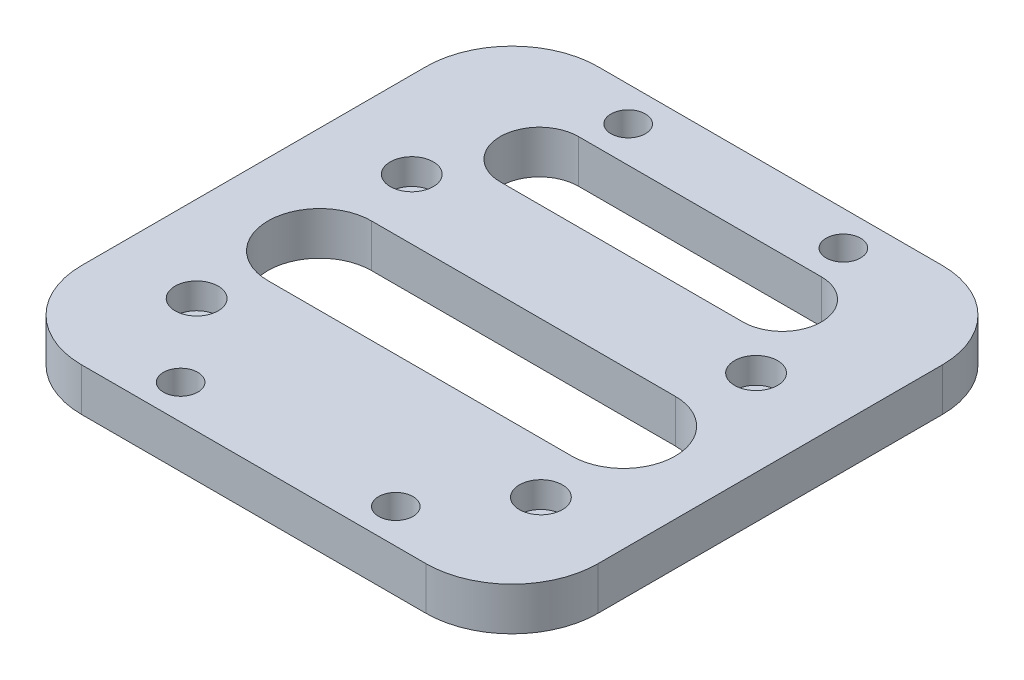
from build123d import *

# Parameters (mm, degrees)
ESQUISSE1_W             = 60
ESQUISSE1_H             = 60
BOSS_EXTRU_1_DEPTH      = 5
ESQUISSE2_R             = 2
ESQUISSE2_R_2           = 1.3
ENL_V_MAT_EXTRU_1_DEPTH = 86
ESQUISSE4_R             = 2.5
ENL_V_MAT_EXTRU_2_DEPTH = 3
CONG_1_R                = 10
ENL_V_MAT_EXTRU_4_DEPTH = 86


with BuildPart() as part:
    # Esquisse1 → Boss.-Extru.1 (new body)
    with BuildSketch(Plane(origin=(0, 0, 0), x_dir=(1, 0, 0), z_dir=(0, 1, 0))):
        with Locations((30, 30)):
            Rectangle(ESQUISSE1_W, ESQUISSE1_H)
    extrude(amount=BOSS_EXTRU_1_DEPTH)

    # Esquisse2 → Enlèv. mat.-Extru.1 (cut, through all)
    with BuildSketch(Plane(origin=(0, 5, 0), x_dir=(1, 0, 0), z_dir=(0, 1, 0))):
        with Locations(Location((17.5, 56, 0), (0, 0, 270))):
            Circle(ESQUISSE2_R)
        with Locations(Location((17.5, 4, 0), (0, 0, 270))):
            Circle(ESQUISSE2_R)
        with Locations(Location((42.5, 4, 0), (0, 0, 270))):
            Circle(ESQUISSE2_R)
        with Locations(Location((42.5, 56, 0), (0, 0, 270))):
            Circle(ESQUISSE2_R)
        with Locations(Location((10, 38.358507613, 0), (0, 0, 270))):
            Circle(ESQUISSE2_R_2)
        with Locations(Location((10, 13.358507613, 0), (0, 0, 270))):
            Circle(ESQUISSE2_R_2)
        with Locations(Location((50, 13.358507613, 0), (0, 0, 270))):
            Circle(ESQUISSE2_R_2)
        with Locations(Location((50, 38.358507613, 0), (0, 0, 270))):
            Circle(ESQUISSE2_R_2)
    extrude(amount=-ENL_V_MAT_EXTRU_1_DEPTH, mode=Mode.SUBTRACT)

    # Esquisse4 → Enlèv. mat.-Extru.2 (cut)
    with BuildSketch(Plane(origin=(0, 5, 0), x_dir=(1, 0, 0), z_dir=(0, 1, 0))):
        with Locations(Location((10, 38.358507613, 0), (0, 0, 270))):
            Circle(ESQUISSE4_R)
        with Locations(Location((10, 13.358507613, 0), (0, 0, 270))):
            Circle(ESQUISSE4_R)
        with Locations(Location((50, 13.358507613, 0), (0, 0, 270))):
            Circle(ESQUISSE4_R)
        with Locations(Location((50, 38.358507613, 0), (0, 0, 270))):
            Circle(ESQUISSE4_R)
    extrude(amount=-ENL_V_MAT_EXTRU_2_DEPTH, mode=Mode.SUBTRACT)

    # Congé1
    cong_1_edges = [part.edges().sort_by_distance(p)[0] for p in [
        (0, 2.5, -60),
        (60, 2.5, -60),
        (60, 2.5, 0),
        (0, 2.5, 0),
    ]]
    fillet(cong_1_edges, radius=CONG_1_R)

    # Esquisse6 → Enlèv. mat.-Extru.4 (cut, through all)
    with BuildSketch(Plane(origin=(0, 5, 0), x_dir=(1, 0, 0), z_dir=(0, 1, 0))):
        with BuildLine():
            Line((15.893584332, 51.834033813), (44.106415668, 51.834033813))
            ThreePointArc((44.106415668, 51.834033813), (48.658685267, 47.281764215), (44.106415668, 42.729494617))
            Line((44.106415668, 42.729494617), (15.893584332, 42.729494617))
            ThreePointArc((15.893584332, 42.729494617), (11.341314733, 47.281764215), (15.893584332, 51.834033813))
        make_face()
        with BuildLine():
            Line((12.3529302, 31.320720192), (47.6470698, 31.320720192))
            ThreePointArc((47.6470698, 31.320720192), (53.660561739, 25.307228254), (47.6470698, 19.293736315))
            Line((47.6470698, 19.293736315), (12.3529302, 19.293736315))
            ThreePointArc((12.3529302, 19.293736315), (6.339438261, 25.307228254), (12.3529302, 31.320720192))
        make_face()
    extrude(amount=-ENL_V_MAT_EXTRU_4_DEPTH, mode=Mode.SUBTRACT)


solid = part.part
